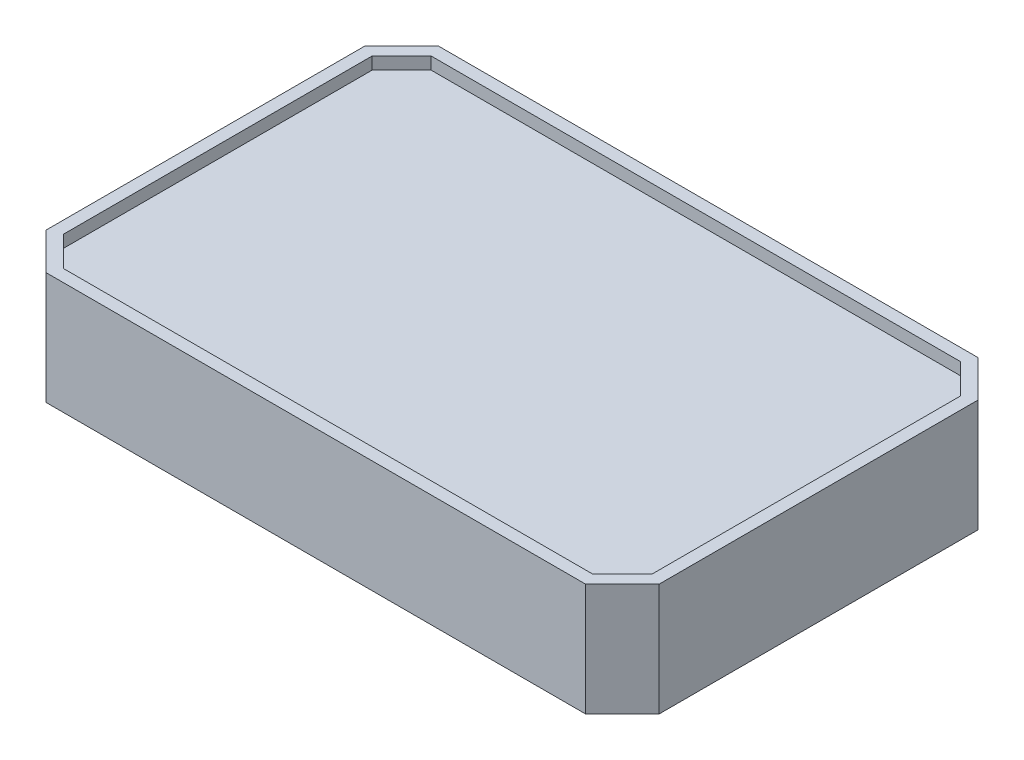
from build123d import *

# Parameters (mm, degrees)
ESBO_O1_W        = 5
ESBO_O1_H        = 3.2
EXTRUS_O1_DEPTH  = 0.917
CHANFRO3_SIZE    = 0.3
CHANFRO4_SIZE    = 0.3
CHANFRO5_SIZE    = 0.3
CHANFRO6_SIZE    = 0.3
EXTRUS_O6_DEPTH  = 0.1
EXTRUS_O8_DEPTH  = 0.1
EXTRUS_O9_DEPTH  = 0.1
EXTRUS_O13_DEPTH = 0.1
EXTRUS_O14_DEPTH = 0.1


with BuildPart() as part:
    # Esboço1 → Extrusão1 (new body)
    with BuildSketch(Plane(origin=(0, 0, 0), x_dir=(1, 0, 0), z_dir=(0, 1, 0))):
        Rectangle(ESBO_O1_W, ESBO_O1_H)
    extrude(amount=EXTRUS_O1_DEPTH)

    # Chanfro3
    chanfro3_edges = [part.edges().sort_by_distance(p)[0] for p in [
        (2.5, 0.4585, 1.6),
    ]]
    chamfer(chanfro3_edges, length=CHANFRO3_SIZE)

    # Chanfro4
    chanfro4_edges = [part.edges().sort_by_distance(p)[0] for p in [
        (-2.5, 0.4585, 1.6),
    ]]
    chamfer(chanfro4_edges, length=CHANFRO4_SIZE)

    # Chanfro5
    chanfro5_edges = [part.edges().sort_by_distance(p)[0] for p in [
        (2.5, 0.4585, -1.6),
    ]]
    chamfer(chanfro5_edges, length=CHANFRO5_SIZE)

    # Chanfro6
    chanfro6_edges = [part.edges().sort_by_distance(p)[0] for p in [
        (-2.5, 0.4585, -1.6),
    ]]
    chamfer(chanfro6_edges, length=CHANFRO6_SIZE)

    # Esboço4 → Extrusão6 (cut)
    with BuildSketch(Plane(origin=(0, 0, 0), x_dir=(1, 0, 0), z_dir=(0, 1, 0))):
        Polygon((1.25, 0.75), (1.25, 1.55), (2.179289322, 1.55), (2.45, 1.279289322), (2.45, 0.75), align=None)
    extrude(amount=EXTRUS_O6_DEPTH, mode=Mode.SUBTRACT)

    # Esboço6 → Extrusão8 (cut)
    with BuildSketch(Plane(origin=(0, 0, 0), x_dir=(1, 0, 0), z_dir=(0, 1, 0))):
        Polygon((1.25, -1.55), (1.25, -0.75), (2.45, -0.75), (2.45, -1.279289322), (2.179289322, -1.55), align=None)
    extrude(amount=EXTRUS_O8_DEPTH, mode=Mode.SUBTRACT)

    # Esboço7 → Extrusão9 (cut)
    with BuildSketch(Plane(origin=(0, 0, 0), x_dir=(1, 0, 0), z_dir=(0, 1, 0))):
        Polygon((-2.45, -0.75), (-1.518700577, -0.75), (-1.25, -1.018700577), (-1.25, -1.55), (-2.179289322, -1.55), (-2.45, -1.279289322), align=None)
    extrude(amount=EXTRUS_O9_DEPTH, mode=Mode.SUBTRACT)

    # Esboço10 → Extrusão13 (cut)
    with BuildSketch(Plane(origin=(0, 0.917, 0), x_dir=(1, 0, 0), z_dir=(0, 1, 0))):
        Polygon((-2.4, 1.258578644), (-2.158578644, 1.5), (2.158578644, 1.5), (2.4, 1.258578644), (2.4, -1.258578644), (2.158578644, -1.5), (-2.158578644, -1.5), (-2.4, -1.258578644), align=None)
    extrude(amount=-EXTRUS_O13_DEPTH, mode=Mode.SUBTRACT)

    # Esboço11 → Extrusão14 (cut)
    with BuildSketch(Plane(origin=(0, 0, 0), x_dir=(1, 0, 0), z_dir=(0, 1, 0))):
        Polygon((-2.45, 1.279289322), (-2.45, 0.75), (-1.25, 0.75), (-1.25, 1.55), (-2.179289322, 1.55), align=None)
    extrude(amount=EXTRUS_O14_DEPTH, mode=Mode.SUBTRACT)


solid = part.part
